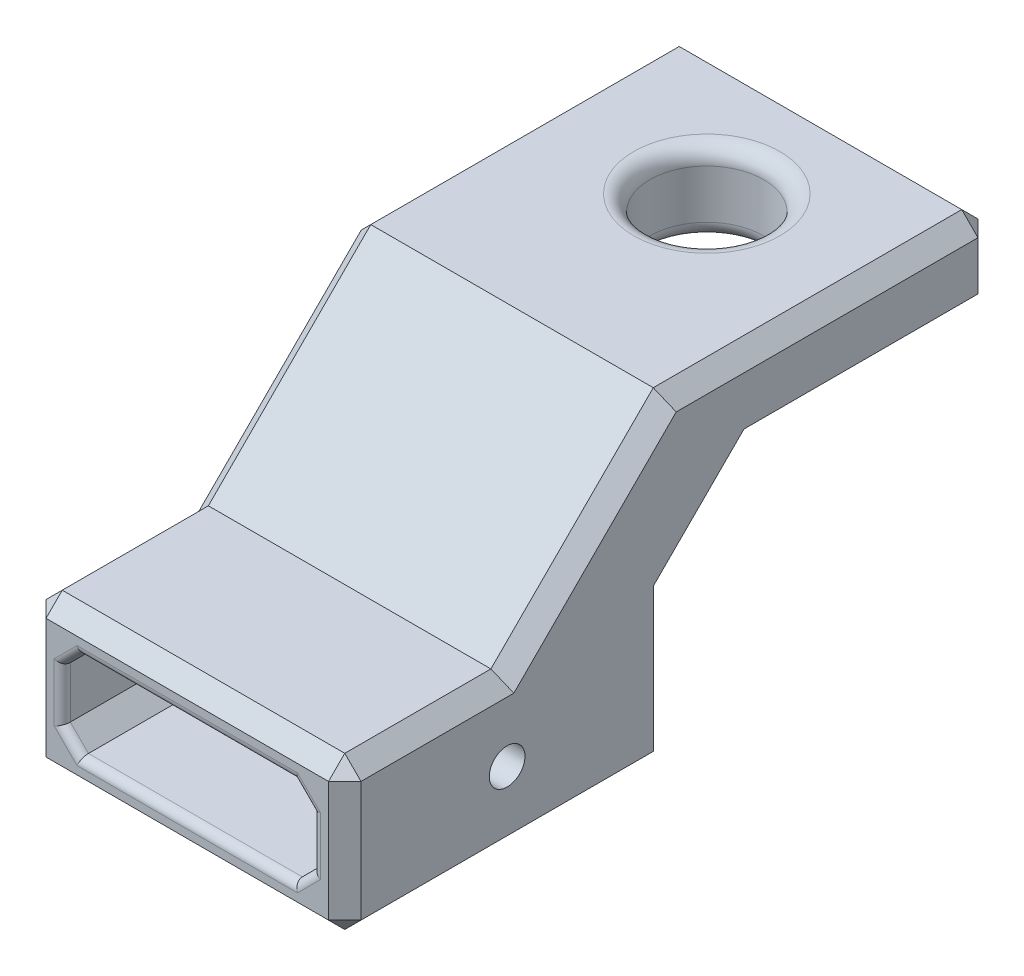
from build123d import *

# Parameters (mm, degrees)
ESBO_O2_W                = 19.4
ESBO_O2_H                = 9.4
RESSALTO_EXTRUS_O1_DEPTH = 20
RESSALTO_EXTRUS_O2_DEPTH = 19.4
CHANFRO2_SIZE            = 1
ESBO_O5_R                = 3.5
CORTE_EXTRUS_O1_DEPTH    = 20
FILETE1_R                = 1
FILETE2_R                = 0.5
ESBO_O6_R                = 1.1
CORTE_EXTRUS_O2_DEPTH    = 10


with BuildPart() as part:
    # Esboço2 → Ressalto-extrusão1 (new body)
    with BuildSketch(Plane.XY):
        with Locations((7.5, 1.5)):
            Rectangle(ESBO_O2_W, ESBO_O2_H)
        Polygon((15.2, 3.082842712), (14.082842712, 4.2), (0.917157288, 4.2), (-0.2, 3.082842712), (-0.2, -0.082842712), (0.917157288, -1.2), (14.082842712, -1.2), (15.2, -0.082842712), align=None, mode=Mode.SUBTRACT)
    extrude(amount=RESSALTO_EXTRUS_O1_DEPTH)

    # Esboço4 → Ressalto-extrusão2 (add)
    with BuildSketch(Plane(origin=(-2.2, 0, 0), x_dir=(0, 0, -1), z_dir=(1, 0, 0))):
        Polygon((0, 16.2), (-10, 6.2), (0, 6.2), (5, 11.2), (20, 11.2), (20, 16.2), align=None)
    extrude(amount=RESSALTO_EXTRUS_O2_DEPTH)

    # Chanfro2
    chanfro2_edges = [part.edges().sort_by_distance(p)[0] for p in [
        (17.2, 1.5, 20),
        (7.5, 6.2, 20),
        (17.2, 11.2, 5),
        (-2.2, 11.2, 5),
        (17.2, 8.7, -2.5),
        (-2.2, 8.7, -2.5),
        (17.2, 11.2, -12.5),
        (-2.2, 11.2, -12.5),
        (17.2, 13.7, -20),
        (7.5, 11.2, -20),
        (-2.2, 13.7, -20),
        (7.5, 16.2, -20),
        (-2.2, 16.2, -10),
        (17.2, 16.2, -10),
        (-2.2, 1.5, 20),
        (17.2, 1.5, 0),
        (7.5, -3.2, 0),
        (-2.2, 1.5, 0),
        (-2.2, 6.2, 15),
        (17.2, 6.2, 15),
        (17.2, -3.2, 10),
        (-2.2, -3.2, 10),
        (7.5, -3.2, 20),
    ]]
    chamfer(chanfro2_edges, length=CHANFRO2_SIZE)

    # Esboço5 → Corte-extrusão1 (cut)
    with BuildSketch(Plane.XZ.offset(-11.2)):
        with Locations(Location((7.5, -12, 0), (0, 0, 270))):
            Circle(ESBO_O5_R)
    extrude(amount=-CORTE_EXTRUS_O1_DEPTH, mode=Mode.SUBTRACT)

    # Filete1
    filete1_edges = [part.edges().sort_by_distance(p)[0] for p in [
        (7.5, 16.2, -8.5),
        (7.5, 11.2, -8.5),
    ]]
    fillet(filete1_edges, radius=FILETE1_R)

    # Filete2
    filete2_edges = [part.edges().sort_by_distance(p)[0] for p in [
        (15.2, 1.5, 0),
        (14.641421356, 3.641421356, 0),
        (7.5, 4.2, 0),
        (0.358578644, 3.641421356, 0),
        (-0.2, 1.5, 0),
        (0.358578644, -0.641421356, 0),
        (7.5, -1.2, 0),
        (14.641421356, -0.641421356, 0),
        (15.2, 1.5, 20),
        (14.641421356, 3.641421356, 20),
        (7.5, 4.2, 20),
        (0.358578644, 3.641421356, 20),
        (-0.2, 1.5, 20),
        (0.358578644, -0.641421356, 20),
        (7.5, -1.2, 20),
        (14.641421356, -0.641421356, 20),
    ]]
    fillet(filete2_edges, radius=FILETE2_R)

    # Esboço6 → Corte-extrusão2 (cut)
    with BuildSketch(Plane(origin=(17.2, 0, 0), x_dir=(0, 0, -1), z_dir=(1, 0, 0))):
        with Locations((-10, 1.5)):
            Circle(ESBO_O6_R)
    extrude(amount=-CORTE_EXTRUS_O2_DEPTH, mode=Mode.SUBTRACT)


solid = part.part
